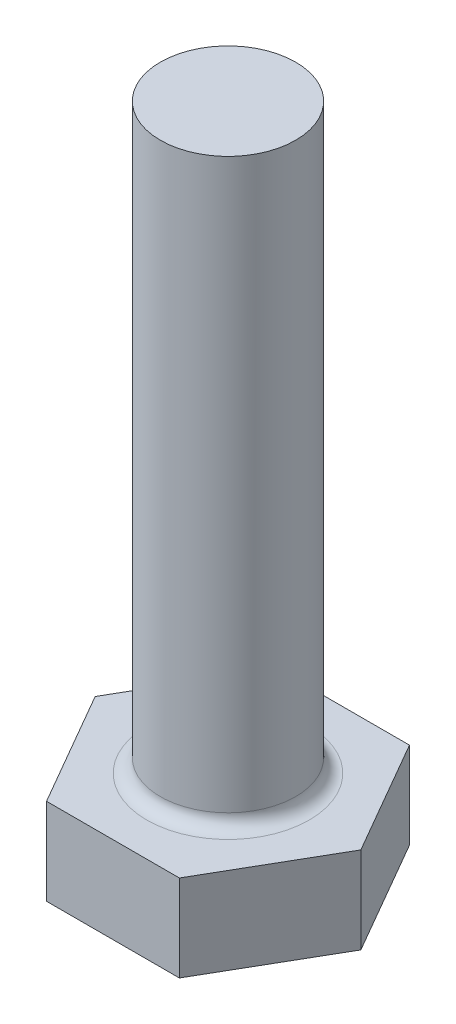
from build123d import *

# Parameters (mm, degrees)
SKETCH1_R           = 5
BOSS_EXTRUDE1_DEPTH = 43
BOSS_EXTRUDE2_DEPTH = 6.4
FILLET1_R           = 1


with BuildPart() as part:
    # Sketch1 → Boss-Extrude1 (new body)
    with BuildSketch(Plane(origin=(0, 0, 0), x_dir=(1, 0, 0), z_dir=(0, 1, 0))):
        with Locations(Location((0, 0, 0), (0, 0, 270))):
            Circle(SKETCH1_R)
    extrude(amount=BOSS_EXTRUDE1_DEPTH)

    # Sketch2 → Boss-Extrude2 (add)
    with BuildSketch(Plane.XZ):
        Polygon((4.907477288, 8.5), (-4.907477288, 8.5), (-9.814954576, 0), (-4.907477288, -8.5), (4.907477288, -8.5), (9.814954576, 0), align=None)
    extrude(amount=BOSS_EXTRUDE2_DEPTH)

    # Fillet1
    fillet1_edges = [part.edges().sort_by_distance(p)[0] for p in [
        (0, 0, -5),
    ]]
    fillet(fillet1_edges, radius=FILLET1_R)


solid = part.part
